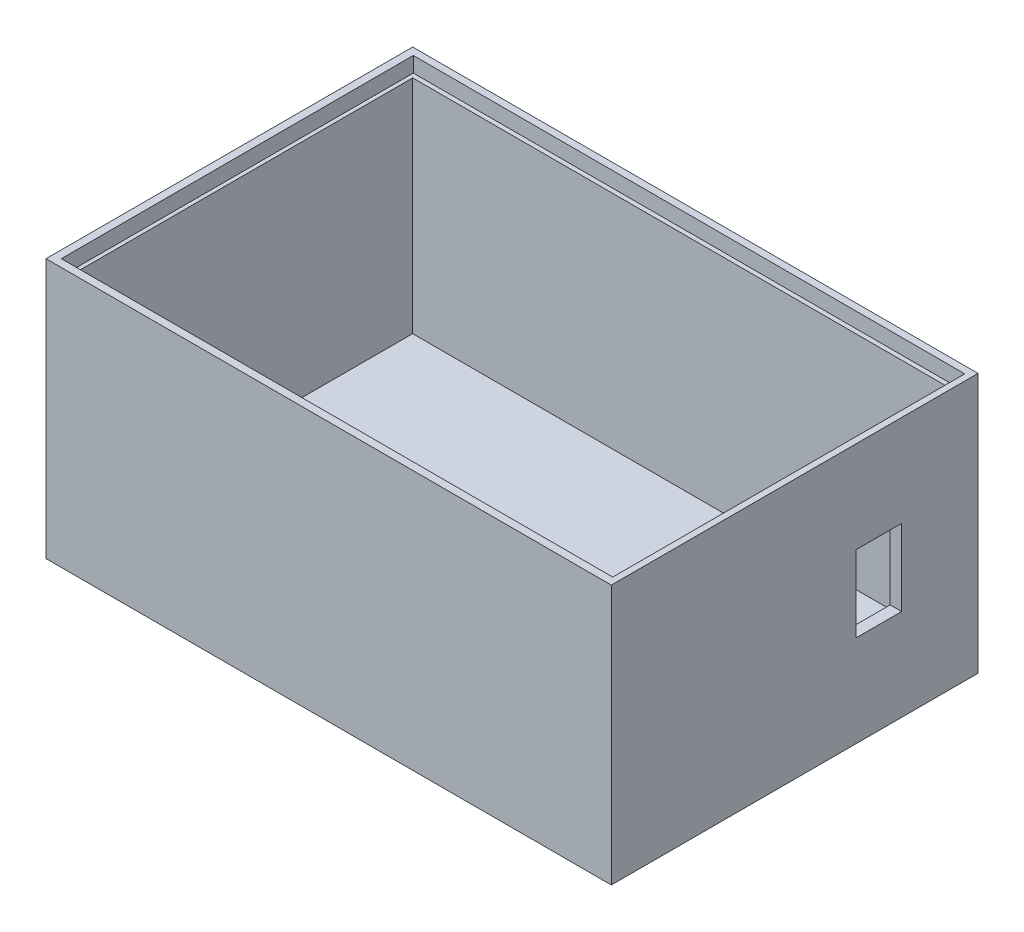
from build123d import *

# Parameters (mm, degrees)
SKETCH1_W           = 74
SKETCH1_H           = 48
BOSS_EXTRUDE1_DEPTH = 34
SKETCH3_W           = 71
SKETCH3_H           = 45
CUT_EXTRUDE1_DEPTH  = 31
SKETCH4_W           = 72.185535561
SKETCH4_H           = 46.080093343
CUT_EXTRUDE2_DEPTH  = 2
SKETCH5_W           = 6
SKETCH5_H           = 10
CUT_EXTRUDE3_DEPTH  = 5


with BuildPart() as part:
    # Sketch1 → Boss-Extrude1 (new body)
    with BuildSketch(Plane(origin=(0, 0, 0), x_dir=(1, 0, 0), z_dir=(0, 1, 0))):
        Rectangle(SKETCH1_W, SKETCH1_H)
    extrude(amount=BOSS_EXTRUDE1_DEPTH)

    # Sketch3 → Cut-Extrude1 (cut)
    with BuildSketch(Plane(origin=(0, 34, 0), x_dir=(1, 0, 0), z_dir=(0, 1, 0))):
        Rectangle(SKETCH3_W, SKETCH3_H)
    extrude(amount=-CUT_EXTRUDE1_DEPTH, mode=Mode.SUBTRACT)

    # Sketch4 → Cut-Extrude2 (cut)
    with BuildSketch(Plane(origin=(0, 34, 0), x_dir=(1, 0, 0), z_dir=(0, 1, 0))):
        with Locations((0.092767781, 0.040046672)):
            Rectangle(SKETCH4_W, SKETCH4_H)
    extrude(amount=-CUT_EXTRUDE2_DEPTH, mode=Mode.SUBTRACT)

    # Sketch5 → Cut-Extrude3 (cut)
    with BuildSketch(Plane(origin=(37, 0, 0), x_dir=(0, 0, -1), z_dir=(1, 0, 0))):
        with Locations((11, 17)):
            Rectangle(SKETCH5_W, SKETCH5_H)
    extrude(amount=-CUT_EXTRUDE3_DEPTH, mode=Mode.SUBTRACT)


solid = part.part
